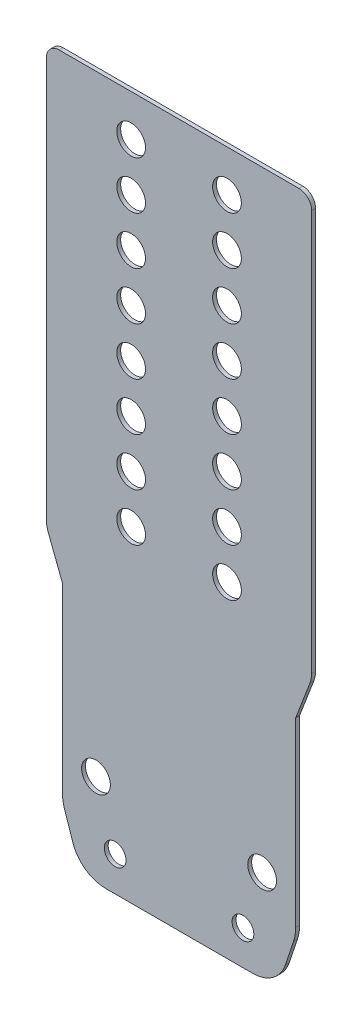
from build123d import *

# Parameters (mm, degrees)
BOSS_EXTRUDE1_DEPTH = 0.6096
SKETCH3_R           = 1.7
SKETCH3_R_2         = 2.25
CUT_EXTRUDE1_DEPTH  = 116.89918728
SKETCH5_R           = 2.25
CUT_EXTRUDE2_DEPTH  = 116.89918728
LPATTERN1_COUNT     = 7
LPATTERN1_PITCH     = 7.5
BOSS_EXTRUDE2_START = -0.6096
BOSS_EXTRUDE2_DEPTH = 0.6096


with BuildPart() as part:
    # Sketch2 → Boss-Extrude1 (new body)
    with BuildSketch(Plane.XY):
        with BuildLine():
            Line((34.883504, 3.686554855), (36.164103759, 7.513864099))
            ThreePointArc((36.164103759, 7.513864099), (36.415476383, 8.531517689), (36.5, 9.576344365))
            Line((36.5, 9.576344365), (36.5, 108))
            ThreePointArc((36.5, 108), (35.914213562, 109.414213562), (34.5, 110))
            Line((34.5, 110), (2, 110))
            ThreePointArc((2, 110), (0.585786438, 109.414213562), (0, 108))
            Line((0, 108), (0, 9.576344365))
            ThreePointArc((0, 9.576344365), (0.084523617, 8.531517689), (0.335896241, 7.513864099))
            Line((0.335896241, 7.513864099), (1.616496, 3.686554855))
            ThreePointArc((1.616496, 3.686554855), (3.582495544, 1.017500497), (6.737443738, 0))
            Line((6.737443738, 0), (29.762556262, 0))
            ThreePointArc((29.762556262, 0), (32.917504456, 1.017500497), (34.883504, 3.686554855))
        make_face()
    extrude(amount=BOSS_EXTRUDE1_DEPTH)

    # Sketch3 → Cut-Extrude1 (cut, through all)
    with BuildSketch(Plane.XY.offset(0.6096)):
        with Locations((8.25, 5.4)):
            Circle(SKETCH3_R)
        with Locations((5.25, 14.4)):
            Circle(SKETCH3_R_2)
        with Locations((10.75, 103.5)):
            Circle(SKETCH3_R_2)
        with Locations(Location((28.25, 5.4, 0), (0, 0, 180))):
            Circle(SKETCH3_R)
        with Locations(Location((31.25, 14.4, 0), (0, 0, 180))):
            Circle(SKETCH3_R_2)
        with Locations(Location((25.75, 103.5, 0), (0, 0, 180))):
            Circle(SKETCH3_R_2)
    extrude(amount=-CUT_EXTRUDE1_DEPTH, mode=Mode.SUBTRACT)

    # Sketch5 → Cut-Extrude2 (cut, through all)
    with BuildSketch(Plane.XY.offset(0.6096)):
        with Locations((10.75, 96)):
            Circle(SKETCH5_R)
        with Locations((25.75, 96)):
            Circle(SKETCH5_R)
    cut_extrude2 = extrude(amount=-CUT_EXTRUDE2_DEPTH, mode=Mode.SUBTRACT)

    # LPattern1: Cut-Extrude2 ×7
    with Locations(*[(0, -i * LPATTERN1_PITCH, 0) for i in range(1, LPATTERN1_COUNT)]):
        add(cut_extrude2, mode=Mode.SUBTRACT)

    # Sketch7 → Boss-Extrude2 (add)
    with BuildSketch(Plane.XY.offset(0.6096).offset(BOSS_EXTRUDE2_START)):
        with BuildLine():
            ThreePointArc((0, 108), (0.585786438, 109.414213562), (2, 110))
            Line((2, 110), (-0.5, 110))
            ThreePointArc((-0.5, 110), (-1.914213562, 109.414213562), (-2.5, 108))
            Line((-2.5, 108), (-2.5, 45.242710622))
            ThreePointArc((-2.5, 45.242710622), (-2.432780804, 44.512481103), (-2.233382425, 43.806794305))
            Line((-2.233382425, 43.806794305), (0, 38))
            Line((0, 38), (0, 108))
        make_face()
        with BuildLine():
            Line((36.5, 108), (36.5, 38))
            Line((36.5, 38), (38.733382425, 43.806794305))
            ThreePointArc((38.733382425, 43.806794305), (38.932780804, 44.512481103), (39, 45.242710622))
            Line((39, 45.242710622), (39, 108))
            ThreePointArc((39, 108), (38.414213562, 109.414213562), (37, 110))
            Line((37, 110), (34.5, 110))
            ThreePointArc((34.5, 110), (35.914213562, 109.414213562), (36.5, 108))
        make_face()
    extrude(amount=BOSS_EXTRUDE2_DEPTH)


solid = part.part
